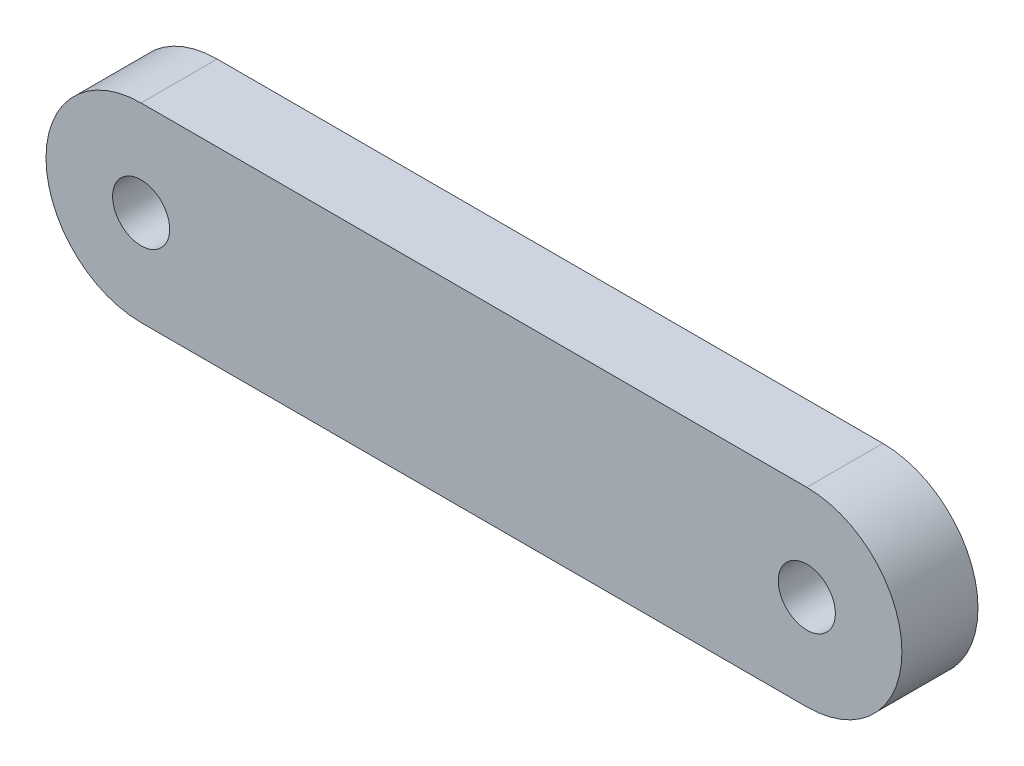
from build123d import *

# Parameters (mm, degrees)
SKETCH1_R           = 1.5
BOSS_EXTRUDE1_DEPTH = 4


with BuildPart() as part:
    # Sketch1 → Boss-Extrude1 (new body)
    with BuildSketch(Plane.XY):
        with BuildLine():
            Line((-35, 5), (0, 5))
            ThreePointArc((0, 5), (5, 0), (0, -5))
            Line((0, -5), (-35, -5))
            ThreePointArc((-35, -5), (-40, 0), (-35, 5))
        make_face()
        with Locations((-35, 0)):
            Circle(SKETCH1_R, mode=Mode.SUBTRACT)
        Circle(SKETCH1_R, mode=Mode.SUBTRACT)
    extrude(amount=BOSS_EXTRUDE1_DEPTH)


solid = part.part
